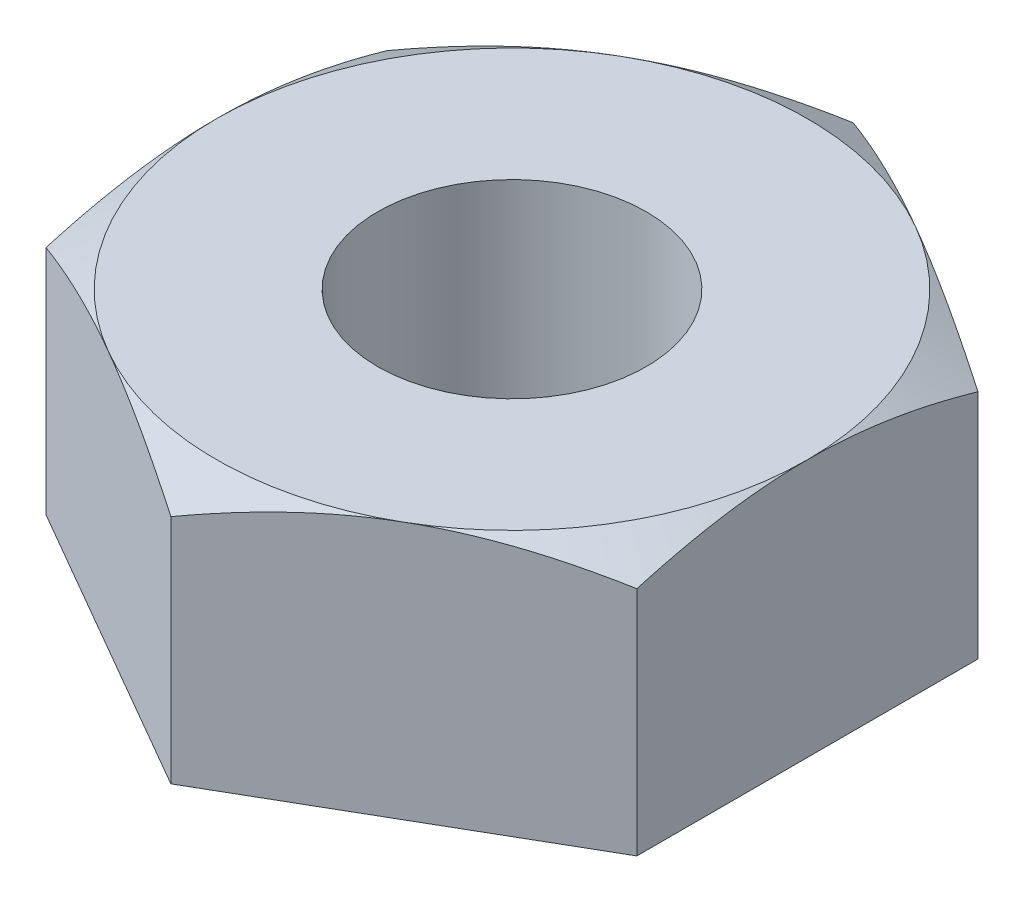
from build123d import *

# Parameters (mm, degrees)
BOSS_EXTRUDE1_DEPTH = 2.4
TAPPED_HOLE1_D      = 2.5


with BuildPart() as part:
    # Sketch1 → Boss-Extrude1 (new body)
    with BuildSketch(Plane(origin=(0, 0, 0), x_dir=(1, 0, 0), z_dir=(0, 1, 0))):
        Polygon((0, 3.175426481), (-2.75, 1.58771324), (-2.75, -1.58771324), (0, -3.175426481), (2.75, -1.58771324), (2.75, 1.58771324), align=None)
    extrude(amount=-BOSS_EXTRUDE1_DEPTH)

    # Sketch2 → Cut-Revolve1 (revolve, cut)
    with BuildSketch(Plane(origin=(0, 0, 0), x_dir=(0, 0, -1), z_dir=(1, 0, 0))):
        Polygon((2.75, 0), (3.175426481, 0), (3.175426481, -0.245620093), align=None)
    revolve(axis=Axis((0, 0, 0), (0, -1, 0)), mode=Mode.SUBTRACT)

    # Tapped Hole1 (through all)
    with Locations(Plane(origin=(0, 0, 0), x_dir=(1, 0, 0), z_dir=(0, 1, 0))):
        with Locations((0, 0)):
            Hole(TAPPED_HOLE1_D / 2)


solid = part.part
